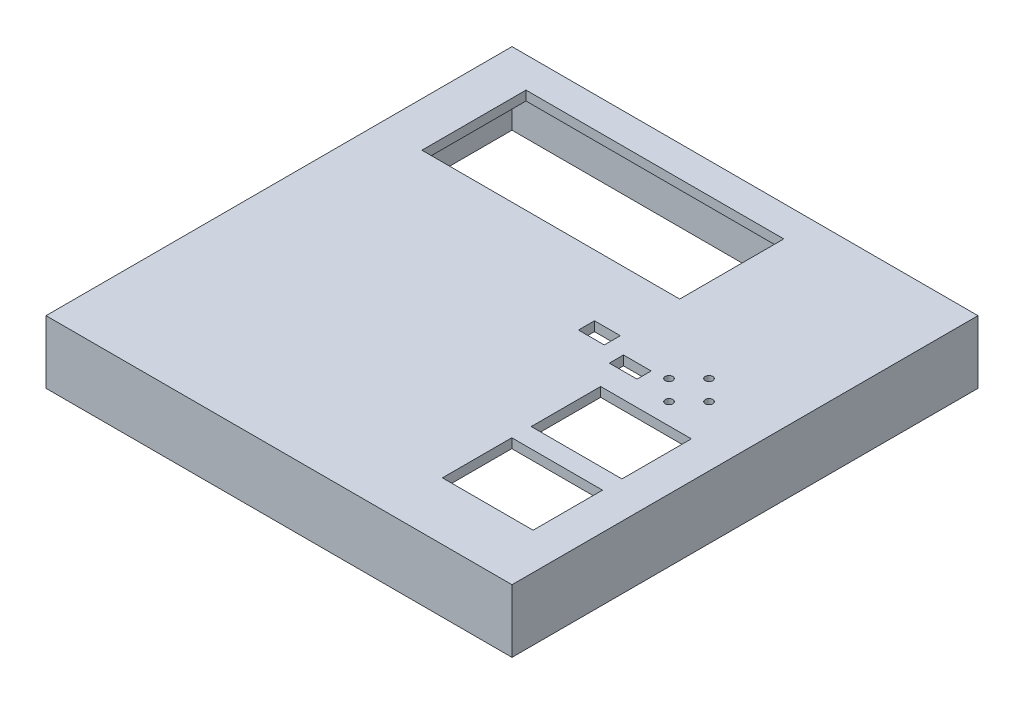
from build123d import *

# Parameters (mm, degrees)
SKETCH1_W           = 94
SKETCH1_H           = 94
BOSS_EXTRUDE1_DEPTH = 12.7
SHELL3_T            = -1.905
SKETCH2_W           = 52
SKETCH2_H           = 21
SKETCH2_W_2         = 18.3
SKETCH2_H_2         = 14
CUT_EXTRUDE2_DEPTH  = 2.54
SKETCH2_11_R        = 0.762
CUT_EXTRUDE4_DEPTH  = 2.54
SKETCH2_12_W        = 5.216658821
SKETCH2_12_H        = 3.236828516
SKETCH2_12_W_2      = 5.589277308
SKETCH2_12_H_2      = 2.856741735
CUT_EXTRUDE5_DEPTH  = 2.54
SKETCH4_W           = 20.251250208
SKETCH4_H           = 6.910379218
CUT_EXTRUDE6_DEPTH  = 2.54


with BuildPart() as part:
    # Sketch1 → Boss-Extrude1 (new body)
    with BuildSketch(Plane(origin=(0, 0, 0), x_dir=(1, 0, 0), z_dir=(0, 1, 0))):
        with Locations((7.550289017, -23.555105973)):
            Rectangle(SKETCH1_W, SKETCH1_H)
    extrude(amount=BOSS_EXTRUDE1_DEPTH)

    # Shell3
    shell3_openings = [part.faces().sort_by_distance(p)[0] for p in [
        (7.550289017, 0, 23.555105973),
    ]]
    offset(amount=SHELL3_T, openings=shell3_openings, kind=Kind.INTERSECTION)

    # Sketch2 → Cut-Extrude2 (cut)
    with BuildSketch(Plane(origin=(0, 12.7, 0), x_dir=(1, 0, 0), z_dir=(0, 1, 0))):
        with Locations((-4.438857176, 6.761825207)):
            Rectangle(SKETCH2_W, SKETCH2_H)
        with Locations((38.011142824, -33.986529837)):
            Rectangle(SKETCH2_W_2, SKETCH2_H_2)
        with Locations((38.011142824, -51.906174793)):
            Rectangle(SKETCH2_W_2, SKETCH2_H_2)
    extrude(amount=-CUT_EXTRUDE2_DEPTH, mode=Mode.SUBTRACT)

    # Sketch2<11> → Cut-Extrude4 (cut)
    with BuildSketch(Plane(origin=(0, 12.7, 0), x_dir=(1, 0, 0), z_dir=(0, 1, 0))):
        with Locations((38.411142824, -14.672051962)):
            Circle(SKETCH2_11_R)
        with Locations((34.377019993, -18.706174793)):
            Circle(SKETCH2_11_R)
        with Locations((38.411142824, -22.740297623)):
            Circle(SKETCH2_11_R)
        with Locations((42.445265655, -18.706174793)):
            Circle(SKETCH2_11_R)
    extrude(amount=-CUT_EXTRUDE4_DEPTH, mode=Mode.SUBTRACT)

    # Sketch2<12> → Cut-Extrude5 (cut)
    with BuildSketch(Plane(origin=(0, 12.7, 0), x_dir=(1, 0, 0), z_dir=(0, 1, 0))):
        with Locations((19.369472235, -17.749589051)):
            Rectangle(SKETCH2_12_W, SKETCH2_12_H)
        with Locations((28.455781478, -20.607545661)):
            Rectangle(SKETCH2_12_W_2, SKETCH2_12_H_2)
    extrude(amount=-CUT_EXTRUDE5_DEPTH, mode=Mode.SUBTRACT)

    # Sketch4 → Cut-Extrude6 (cut)
    with BuildSketch(Plane.ZY.offset(39.449710983)):
        with Locations((34.355105973, 6.110056277)):
            Rectangle(SKETCH4_W, SKETCH4_H)
    extrude(amount=-CUT_EXTRUDE6_DEPTH, mode=Mode.SUBTRACT)


solid = part.part
